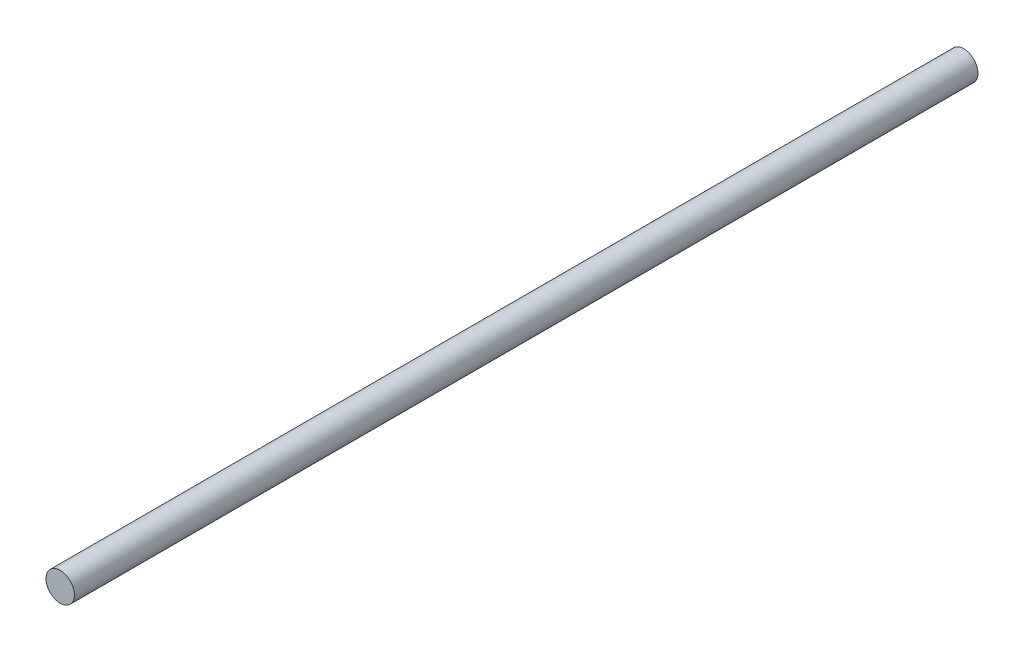
from build123d import *

# Parameters (mm, degrees)
SKETCH1_R           = 3.175
BOSS_EXTRUDE1_DEPTH = 201.422


with BuildPart() as part:
    # Sketch1 → Boss-Extrude1 (new body)
    with BuildSketch(Plane.XY):
        Circle(SKETCH1_R)
    extrude(amount=-BOSS_EXTRUDE1_DEPTH)


solid = part.part
